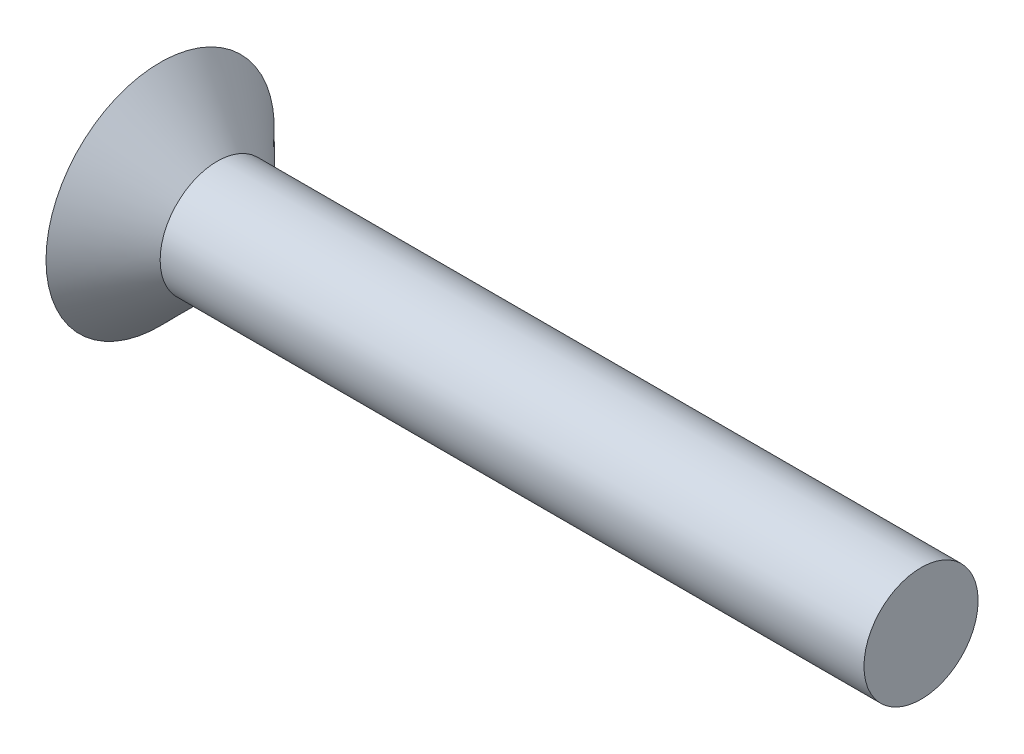
from build123d import *

# Parameters (mm, degrees)
CUT_EXTRUDE_1_DEPTH = 1


with BuildPart() as part:
    # 草图1 → 旋转1 (revolve)
    with BuildSketch(Plane.XY, mode=Mode.PRIVATE) as revolve_1_sk:
        Polygon((0, 0), (0, 3), (1.5, 1.5), (20, 1.5), (20, 0), align=None)
    revolve(revolve_1_sk.sketch.rotate(Axis((0, 0, 0), (1, 0, 0)), 90), axis=Axis((0, 0, 0), (1, 0, 0)))

    # 草图2 → 切除-拉伸1 (cut)
    with BuildSketch(Plane.ZY):
        Polygon((0, 1.154700538), (-1, 0.577350269), (-1, -0.577350269), (0, -1.154700538), (1, -0.577350269), (1, 0.577350269), align=None)
    extrude(amount=-CUT_EXTRUDE_1_DEPTH, mode=Mode.SUBTRACT)


solid = part.part
